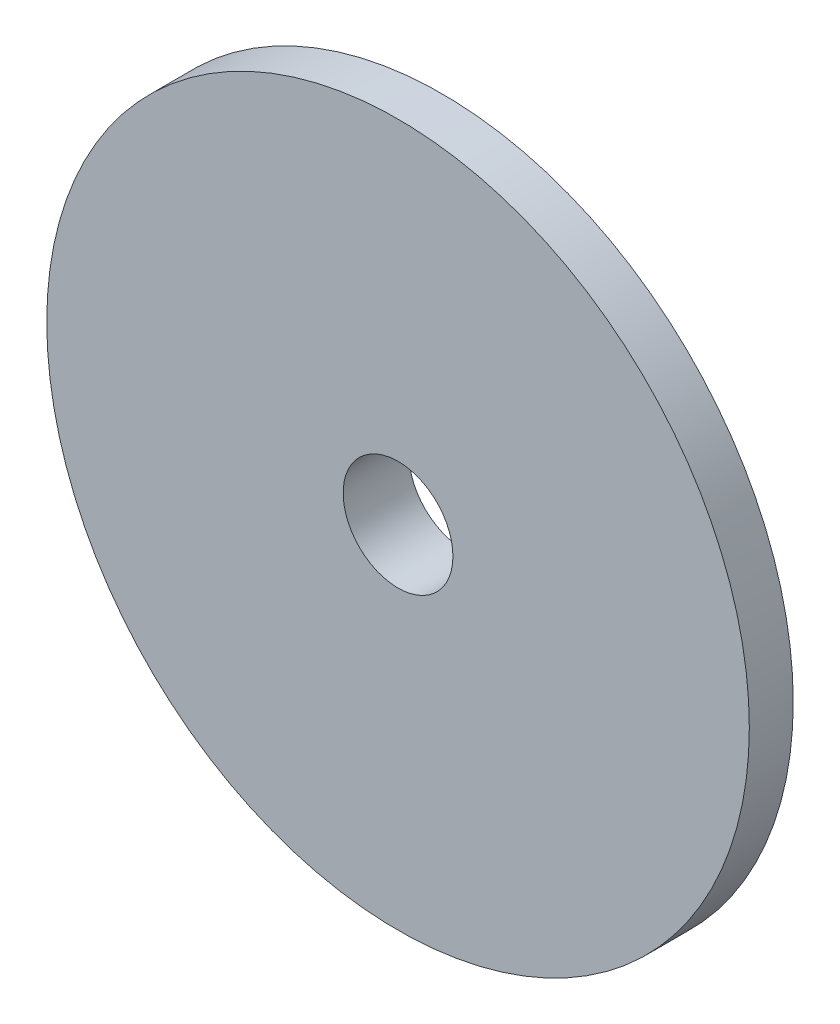
from build123d import *

# Parameters (mm, degrees)
SKETCH1_R    = 19.95
SKETCH1_R_2  = 5
SPIGOT_DEPTH = 2
SKETCH2_R    = 32
SKETCH2_R_2  = 5
PLATE_DEPTH  = 4


with BuildPart() as part:
    # Sketch1 → Spigot (new body)
    with BuildSketch(Plane.XY):
        Circle(SKETCH1_R)
        Circle(SKETCH1_R_2, mode=Mode.SUBTRACT)
    extrude(amount=SPIGOT_DEPTH)

    # Sketch2 → Plate (add)
    with BuildSketch(Plane.XY.offset(2)):
        Circle(SKETCH2_R)
        Circle(SKETCH2_R_2, mode=Mode.SUBTRACT)
    extrude(amount=PLATE_DEPTH)


solid = part.part
